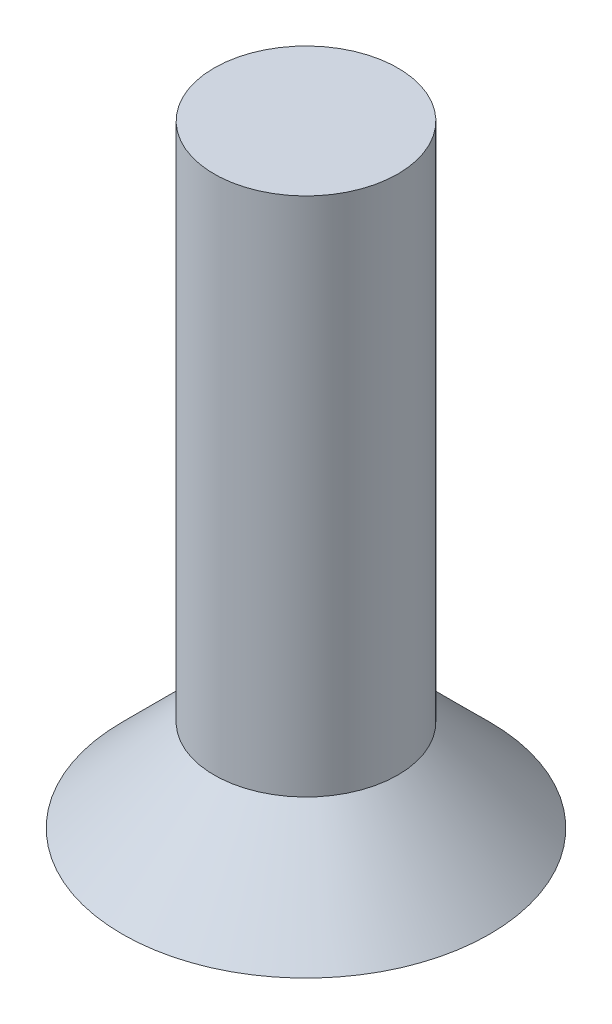
from build123d import *


with BuildPart() as part:
    # Эскиз1 → Revolve 353 (revolve)
    with BuildSketch(Plane.XY):
        Polygon((0, 0), (-3, 0), (-1.5, 1.5), (-1.5, 10), (0, 10), align=None)
    revolve(axis=Axis((0, 10, 0), (0, -1, 0)))


solid = part.part
